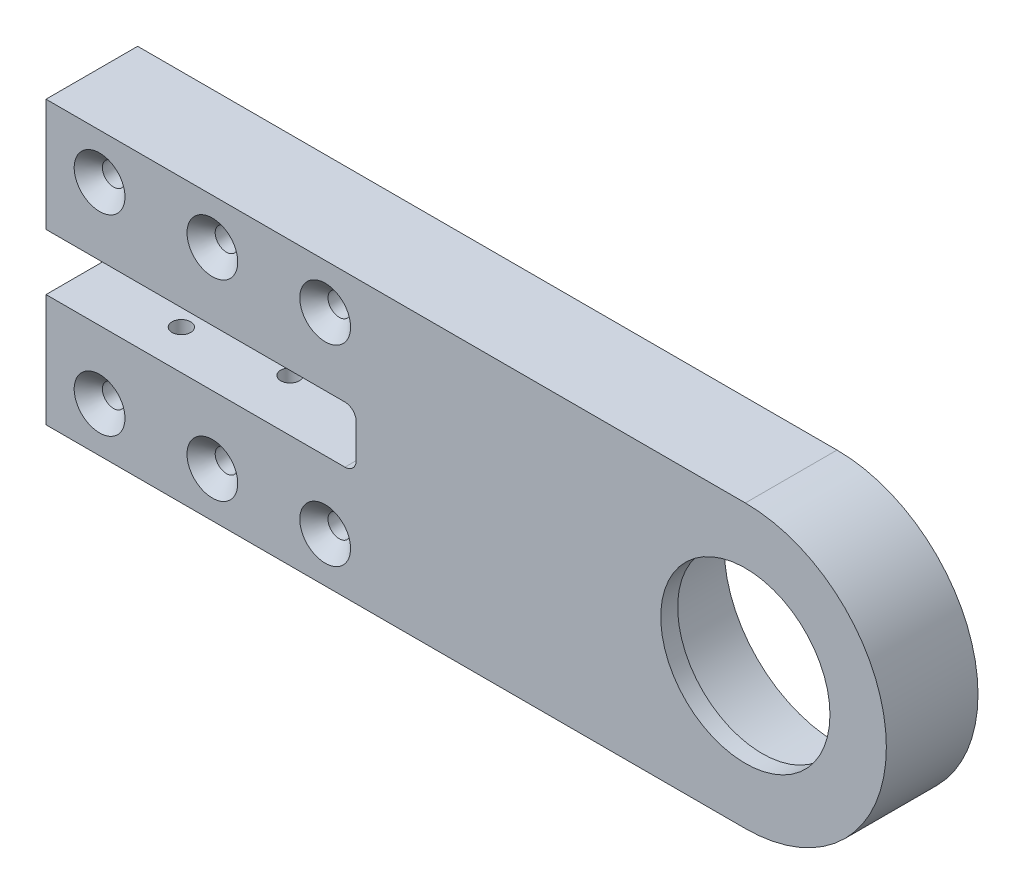
from build123d import *

# Parameters (mm, degrees)
SKETCH1_R                                       = 20
SKETCH1_R_2                                     = 2
BOSS_EXTRUDE1_DEPTH                             = 16.25
BOSS_EXTRUDE2_START                             = -3
SKETCH2_R                                       = 20
SKETCH2_R_2                                     = 15
BOSS_EXTRUDE2_DEPTH                             = 3
CSK_FOR_M5_FLAT_HEAD_MACHINE_SCREW1_D           = 4
CSK_FOR_M5_FLAT_HEAD_MACHINE_SCREW1_CSINK_D     = 9
CSK_FOR_M5_FLAT_HEAD_MACHINE_SCREW1_CSINK_ANGLE = 90
CUT_EXTRUDE1_REACH                              = 103.652
SKETCH7_R                                       = 1.65


with BuildPart() as part:
    # Sketch1 → Boss-Extrude1 (new body)
    with BuildSketch(Plane.XY):
        with BuildLine():
            Line((-62, 5), (-9, 5))
            ThreePointArc((-9, 5), (-7.585786438, 4.414213562), (-7, 3))
            Line((-7, 3), (-7, -3))
            ThreePointArc((-7, -3), (-7.585786438, -4.414213562), (-9, -5))
            Line((-9, -5), (-62, -5))
            Line((-62, -5), (-62, -25))
            Line((-62, -25), (62, -25))
            ThreePointArc((62, -25), (87, 0), (62, 25))
            Line((62, 25), (-62, 25))
            Line((-62, 25), (-62, 5))
        make_face()
        with Locations((62, 0)):
            Circle(SKETCH1_R, mode=Mode.SUBTRACT)
        with Locations((-52.5, 17)):
            Circle(SKETCH1_R_2, mode=Mode.SUBTRACT)
        with Locations((-32.5, 17)):
            Circle(SKETCH1_R_2, mode=Mode.SUBTRACT)
        with Locations((-12.5, 17)):
            Circle(SKETCH1_R_2, mode=Mode.SUBTRACT)
        with Locations((-32.5, -17)):
            Circle(SKETCH1_R_2, mode=Mode.SUBTRACT)
        with Locations((-12.5, -17)):
            Circle(SKETCH1_R_2, mode=Mode.SUBTRACT)
        with Locations((-52.5, -17)):
            Circle(SKETCH1_R_2, mode=Mode.SUBTRACT)
    extrude(amount=BOSS_EXTRUDE1_DEPTH)

    # Sketch2 → Boss-Extrude2 (add)
    with BuildSketch(Plane.XY.offset(16.25).offset(BOSS_EXTRUDE2_START)):
        with Locations((62, 0)):
            Circle(SKETCH2_R)
        with Locations((62, 0)):
            Circle(SKETCH2_R_2, mode=Mode.SUBTRACT)
    extrude(amount=BOSS_EXTRUDE2_DEPTH)

    # CSK for M5 Flat Head Machine Screw1 (through all)
    with Locations(Plane.XY.offset(16.25)):
        with Locations((-52.5, 17), (-32.5, 17), (-12.5, 17), (-52.5, -17), (-32.5, -17), (-12.5, -17)):
            CounterSinkHole(CSK_FOR_M5_FLAT_HEAD_MACHINE_SCREW1_D / 2, CSK_FOR_M5_FLAT_HEAD_MACHINE_SCREW1_CSINK_D / 2, counter_sink_angle=CSK_FOR_M5_FLAT_HEAD_MACHINE_SCREW1_CSINK_ANGLE)

    # Sketch7 → Cut-Extrude1 (cut, up to next)
    with BuildSketch(Plane.XZ.offset(25), mode=Mode.PRIVATE) as cut_extrude1_sk1:
        with Locations(Location((-45, 9.25, 0), (0, 0, 270))):
            Circle(SKETCH7_R)
    cut_extrude1_tool1 = extrude(cut_extrude1_sk1.sketch, amount=-CUT_EXTRUDE1_REACH, mode=Mode.PRIVATE) & part.part
    # Sketch7 → Cut-Extrude1 (cut, up to next)
    with BuildSketch(Plane.XZ.offset(25), mode=Mode.PRIVATE) as cut_extrude1_sk2:
        with Locations(Location((-27.943596514, 7.032095554, 0), (0, 0, 270))):
            Circle(SKETCH7_R)
    cut_extrude1_tool2 = extrude(cut_extrude1_sk2.sketch, amount=-CUT_EXTRUDE1_REACH, mode=Mode.PRIVATE) & part.part
    add(cut_extrude1_tool1.solids().sort_by_distance((-45, -25, 9.25))[0], mode=Mode.SUBTRACT)
    add(cut_extrude1_tool2.solids().sort_by_distance((-27.943597, -25, 7.032096))[0], mode=Mode.SUBTRACT)


solid = part.part
